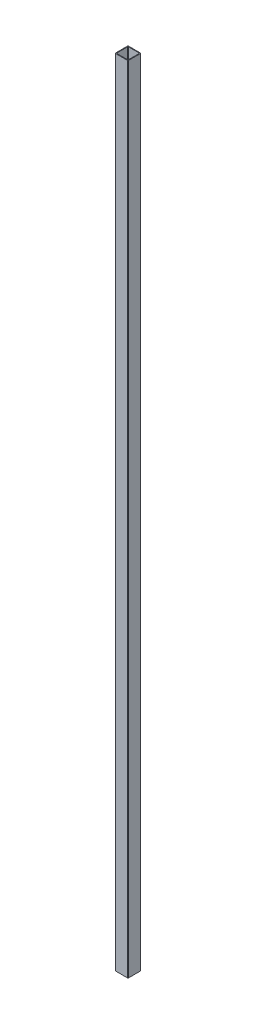
from build123d import *

# Parameters (mm, degrees)
EXTRUDE_1_DEPTH = 2460


with BuildPart() as part:
    # Эскиз2 → Бобышка-Вытянуть1 (new body)
    with BuildSketch(Plane(origin=(0, 0, 0), x_dir=(1, 0, 0), z_dir=(0, 1, 0))):
        with BuildLine():
            Line((-18, 20), (18, 20))
            ThreePointArc((18, 20), (19.414213562, 19.414213562), (20, 18))
            Line((20, 18), (20, -18))
            ThreePointArc((20, -18), (19.414213562, -19.414213562), (18, -20))
            Line((18, -20), (-18, -20))
            ThreePointArc((-18, -20), (-19.414213562, -19.414213562), (-20, -18))
            Line((-20, -18), (-20, 18))
            ThreePointArc((-20, 18), (-19.414213562, 19.414213562), (-18, 20))
        make_face()
        with BuildLine():
            Line((16, -18), (-16, -18))
            ThreePointArc((-16, -18), (-17.414213562, -17.414213562), (-18, -16))
            Line((-18, -16), (-18, 16))
            ThreePointArc((-18, 16), (-17.414213562, 17.414213562), (-16, 18))
            Line((-16, 18), (16, 18))
            ThreePointArc((16, 18), (17.414213562, 17.414213562), (18, 16))
            Line((18, 16), (18, -16))
            ThreePointArc((18, -16), (17.414213562, -17.414213562), (16, -18))
        make_face(mode=Mode.SUBTRACT)
    extrude(amount=EXTRUDE_1_DEPTH)


solid = part.part
